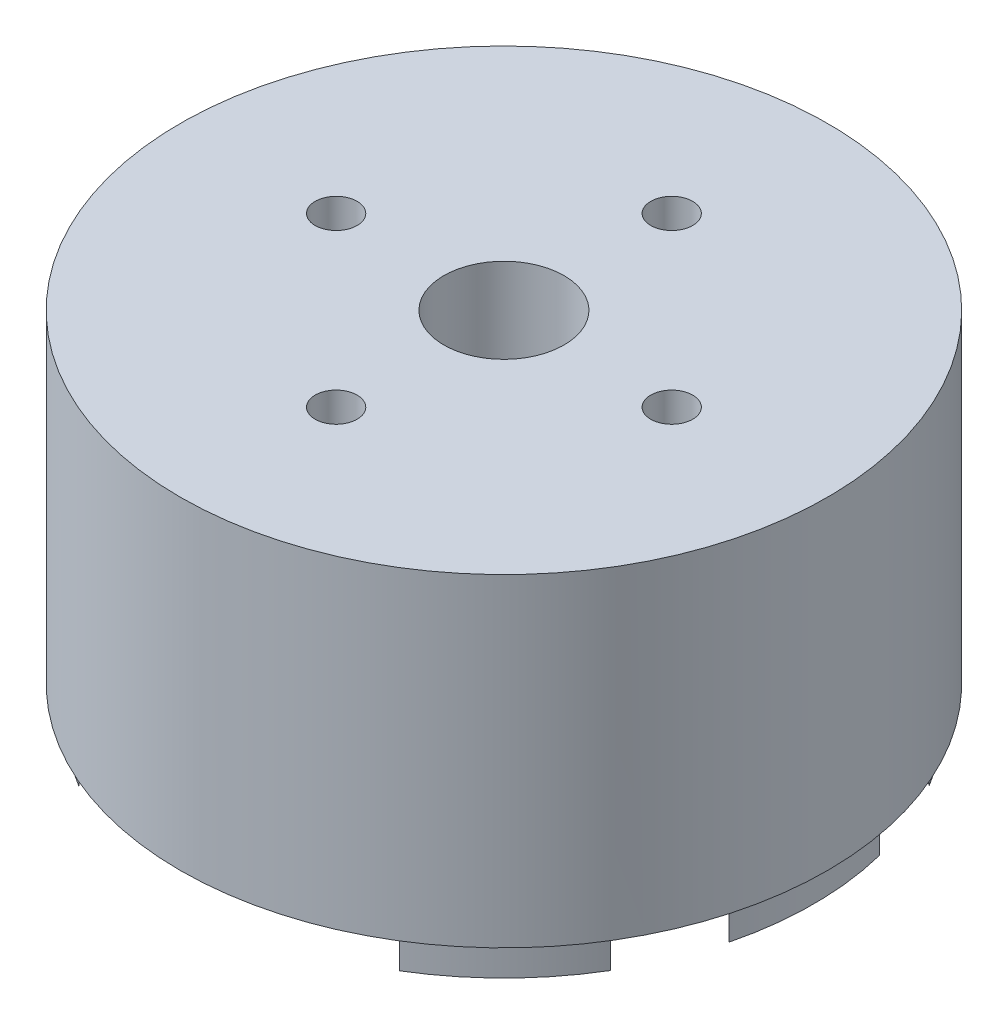
from build123d import *
from build123d.topology import SkipClean

# Parameters (mm, degrees)
EXTRUDE_1_DEPTH          = 12.85
EXTRUDE_1_DEPTH_BACK     = 12.85
SKETCH_1_R               = 23.15
CUT_EXTRUDE_1_DEPTH      = 12.85
CUT_EXTRUDE_1_DEPTH_BACK = 12.85
SKETCH_2_R               = 4.3
SKETCH_5_R               = 4.3
SKETCH_5_R_2             = 1
CUT_EXTRUDE_2_DEPTH      = 6
SKETCH_7_R               = 23.15
SKETCH_7_R_2             = 22.15
CUT_EXTRUDE_8_DEPTH      = 2.58
CUT_EXTRUDE_START        = 4
CUT_EXTRUDE_10_DEPTH     = 4
EXTRUDE_2_DEPTH          = 1
EXTRUDE_START            = 3.42
SKETCH_11_R              = 1.5
EXTRUDE_3_DEPTH          = 3.42
SKETCH_12_R              = 1.5
CUT_EXTRUDE_11_DEPTH     = 10


with BuildPart() as part:
    # 草图1 → 凸台-拉伸1 (new, two sides: drawn at the far end of the back side and taken through both)
    with BuildSketch(Plane(origin=(0, 0, 0), x_dir=(1, 0, 0), z_dir=(0, 1, 0)).offset(-EXTRUDE_1_DEPTH_BACK)):
        with Locations(Location((0, 0, 0), (0, 0, 270))):
            Circle(SKETCH_1_R)
    extrude(amount=EXTRUDE_1_DEPTH + EXTRUDE_1_DEPTH_BACK)

    # 草图2 → 切除-拉伸1 (cut, two sides: drawn at the far end of the back side and taken through both)
    with BuildSketch(Plane(origin=(0, 0, 0), x_dir=(1, 0, 0), z_dir=(0, 1, 0)).offset(-CUT_EXTRUDE_1_DEPTH_BACK)):
        with Locations(Location((0, 0, 0), (0, 0, 90))):
            Circle(SKETCH_2_R)
    extrude(amount=CUT_EXTRUDE_1_DEPTH + CUT_EXTRUDE_1_DEPTH_BACK, mode=Mode.SUBTRACT)

    # 草图5 → 切除-拉伸2 (cut)
    # profile 1 of 7: a face of its own
    with BuildSketch(Plane.XZ.offset(12.85)):
        with BuildLine():
            add(Edge.make_bspline(
                [(20.802536608, 3.817979922), (21.136448657, 2.765502233), (20.402439024, 1.997619047)],
                knots=[0, 0, 0, 1, 1, 1], degree=2))
            add(Edge.make_bspline(
                [(20.802536608, 3.817979922), (21.554654611, 4.402965713), (21.485410101, 5.38513257)],
                knots=[0, 0, 0, 1, 1, 1], degree=2))
            ThreePointArc((21.485410101, 5.38513257), (20.463931645, 8.476438027), (19.000342937, 11.384615421))
            add(Edge.make_bspline(
                [(17.409334195, 12.009895208), (18.354809355, 12.128075529), (19.000342937, 11.384615421)],
                knots=[0, 0, 0, 1, 1, 1], degree=2))
            add(Edge.make_bspline(
                [(17.409334195, 12.009895208), (16.901231558, 12.990220793), (15.839232961, 13.014173013)],
                knots=[0, 0, 0, 1, 1, 1], degree=2))
            ThreePointArc((15.839232961, 13.014173013), (13.081475452, 13.081475452), (13.014173013, 15.839232961))
            add(Edge.make_bspline(
                [(12.009895208, 17.409334195), (12.990220793, 16.901231558), (13.014173013, 15.839232961)],
                knots=[0, 0, 0, 1, 1, 1], degree=2))
            add(Edge.make_bspline(
                [(12.009895208, 17.409334195), (12.11724016, 18.301586859), (11.468959869, 18.949550378)],
                knots=[0, 0, 0, 1, 1, 1], degree=2))
            ThreePointArc((11.468959869, 18.949550378), (7.862702232, 20.707496556), (3.998499067, 21.786108079))
            ThreePointArc((3.998499067, 21.786108079), (0, 22.15), (-3.998499067, 21.786108079))
            ThreePointArc((-3.998499067, 21.786108079), (-7.816660073, 20.724920393), (-11.384615421, 19.000342937))
            add(Edge.make_bspline(
                [(-12.009895208, 17.409334195), (-12.128075529, 18.354809355), (-11.384615421, 19.000342937)],
                knots=[0, 0, 0, 1, 1, 1], degree=2))
            add(Edge.make_bspline(
                [(-12.009895208, 17.409334195), (-12.990220793, 16.901231558), (-13.014173013, 15.839232961)],
                knots=[0, 0, 0, 1, 1, 1], degree=2))
            ThreePointArc((-13.014173013, 15.839232961), (-13.081475452, 13.081475452), (-15.839232961, 13.014173013))
            add(Edge.make_bspline(
                [(-17.409334195, 12.009895208), (-16.901231558, 12.990220793), (-15.839232961, 13.014173013)],
                knots=[0, 0, 0, 1, 1, 1], degree=2))
            add(Edge.make_bspline(
                [(-17.409334195, 12.009895208), (-18.317519727, 12.120793632), (-18.964787718, 11.443746188)],
                knots=[0, 0, 0, 1, 1, 1], degree=2))
            ThreePointArc((-18.964787718, 11.443746188), (-20.450704771, 8.508300321), (-21.485410101, 5.38513257))
            add(Edge.make_bspline(
                [(-20.802536608, 3.817979922), (-21.554654611, 4.402965713), (-21.485410101, 5.38513257)],
                knots=[0, 0, 0, 1, 1, 1], degree=2))
            add(Edge.make_bspline(
                [(-20.802536608, 3.817979922), (-21.136448657, 2.765502233), (-20.402439024, 1.997619047)],
                knots=[0, 0, 0, 1, 1, 1], degree=2))
            ThreePointArc((-20.402439024, 1.997619047), (-18.5, 0), (-20.402439024, -1.997619047))
            add(Edge.make_bspline(
                [(-20.802536608, -3.817979922), (-21.136448657, -2.765502233), (-20.402439024, -1.997619047)],
                knots=[0, 0, 0, 1, 1, 1], degree=2))
            add(Edge.make_bspline(
                [(-20.802536608, -3.817979922), (-21.554654611, -4.402965713), (-21.485410101, -5.38513257)],
                knots=[0, 0, 0, 1, 1, 1], degree=2))
            ThreePointArc((-21.485410101, -5.38513257), (-20.44160266, -8.530145409), (-18.940290978, -11.484244758))
            add(Edge.make_bspline(
                [(-17.409334195, -12.009895208), (-18.291922365, -12.11493984), (-18.940290978, -11.484244758)],
                knots=[0, 0, 0, 1, 1, 1], degree=2))
            add(Edge.make_bspline(
                [(-17.409334195, -12.009895208), (-16.901231558, -12.990220793), (-15.839232961, -13.014173013)],
                knots=[0, 0, 0, 1, 1, 1], degree=2))
            ThreePointArc((-15.839232961, -13.014173013), (-13.081475452, -13.081475452), (-13.014173013, -15.839232961))
            add(Edge.make_bspline(
                [(-12.009895208, -17.409334195), (-12.990220793, -16.901231558), (-13.014173013, -15.839232961)],
                knots=[0, 0, 0, 1, 1, 1], degree=2))
            add(Edge.make_bspline(
                [(-12.009895208, -17.409334195), (-12.128075529, -18.354809355), (-11.384615421, -19.000342937)],
                knots=[0, 0, 0, 1, 1, 1], degree=2))
            ThreePointArc((-11.384615421, -19.000342937), (-7.816660073, -20.724920393), (-3.998499067, -21.786108079))
            ThreePointArc((-3.998499067, -21.786108079), (0, -22.15), (3.998499067, -21.786108079))
            ThreePointArc((3.998499067, -21.786108079), (7.68019027, -20.775879703), (11.133718408, -19.148441566))
            add(Edge.make_bspline(
                [(12.009895208, -17.409334195), (12.147339907, -18.511130847), (11.133718408, -19.148441566)],
                knots=[0, 0, 0, 1, 1, 1], degree=2))
            add(Edge.make_bspline(
                [(12.009895208, -17.409334195), (12.990220793, -16.901231558), (13.014173013, -15.839232961)],
                knots=[0, 0, 0, 1, 1, 1], degree=2))
            ThreePointArc((13.014173013, -15.839232961), (13.081475452, -13.081475452), (15.839232961, -13.014173013))
            add(Edge.make_bspline(
                [(17.409334195, -12.009895208), (16.901231558, -12.990220793), (15.839232961, -13.014173013)],
                knots=[0, 0, 0, 1, 1, 1], degree=2))
            add(Edge.make_bspline(
                [(17.409334195, -12.009895208), (18.354809355, -12.128075529), (19.000342937, -11.384615421)],
                knots=[0, 0, 0, 1, 1, 1], degree=2))
            ThreePointArc((19.000342937, -11.384615421), (20.463931645, -8.476438027), (21.485410101, -5.38513257))
            add(Edge.make_bspline(
                [(20.802536608, -3.817979922), (21.554654611, -4.402965713), (21.485410101, -5.38513257)],
                knots=[0, 0, 0, 1, 1, 1], degree=2))
            add(Edge.make_bspline(
                [(20.802536608, -3.817979922), (21.136448657, -2.765502233), (20.402439024, -1.997619047)],
                knots=[0, 0, 0, 1, 1, 1], degree=2))
            ThreePointArc((20.402439024, -1.997619047), (18.5, 0), (20.402439024, 1.997619047))
        make_face()
        with Locations(Location((0, 0, 0), (0, 0, 270))):
            Circle(SKETCH_5_R, mode=Mode.SUBTRACT)
    # profile 2 of 7: a face of its own
    with BuildSketch(Plane.XZ.offset(12.85)):
        with Locations(Location((20.5, 0, 0), (0, 0, 270))):
            Circle(SKETCH_5_R_2)
    # profile 3 of 7: a face of its own
    with BuildSketch(Plane.XZ.offset(12.85)):
        with Locations(Location((14.495689014, -14.495689014, 0), (0, 0, 270))):
            Circle(SKETCH_5_R_2)
    # profile 4 of 7: a face of its own
    with BuildSketch(Plane.XZ.offset(12.85)):
        with Locations(Location((-14.495689014, -14.495689014, 0), (0, 0, 270))):
            Circle(SKETCH_5_R_2)
    # profile 5 of 7: a face of its own
    with BuildSketch(Plane.XZ.offset(12.85)):
        with Locations(Location((-20.5, 0, 0), (0, 0, 270))):
            Circle(SKETCH_5_R_2)
    # profile 6 of 7: a face of its own
    with BuildSketch(Plane.XZ.offset(12.85)):
        with Locations(Location((-14.495689014, 14.495689014, 0), (0, 0, 270))):
            Circle(SKETCH_5_R_2)
    # profile 7 of 7: a face of its own
    with BuildSketch(Plane.XZ.offset(12.85)):
        with Locations(Location((14.495689014, 14.495689014, 0), (0, 0, 270))):
            Circle(SKETCH_5_R_2)
    extrude(amount=-CUT_EXTRUDE_2_DEPTH, mode=Mode.SUBTRACT)

    # 草图7 → 切除-拉伸8 (cut)
    with BuildSketch(Plane.XZ.offset(12.85)):
        with Locations(Location((0, 0, 0), (0, 0, 90))):
            Circle(SKETCH_7_R)
        Circle(SKETCH_7_R_2, mode=Mode.SUBTRACT)
    extrude(amount=-CUT_EXTRUDE_8_DEPTH, mode=Mode.SUBTRACT)

    # 草图10 → 切除-拉伸10 (cut)
    with BuildSketch(Plane.XZ.offset(6.85).offset(CUT_EXTRUDE_START)):
        with BuildLine():
            Line((-9, -21.328912302), (-9, -20.239132887))
            ThreePointArc((-9, -20.239132887), (0, -22.15), (9, -20.239132887))
            Line((9, -20.239132887), (9, -21.328912302))
            ThreePointArc((9, -21.328912302), (0, -23.15), (-9, -21.328912302))
        make_face()
    extrude(amount=-CUT_EXTRUDE_10_DEPTH, mode=Mode.SUBTRACT)

    # 草图9 → 凸台-拉伸2 (add)
    with SkipClean():  # the faces are left unmerged after this step: merging them gives an invalid solid
        with BuildSketch(Plane(origin=(0, -7.85, 0), x_dir=(-1, 0, 0), z_dir=(0, -1, 0))):
            with BuildLine():
                Line((-9, 21.328912302), (-9, 20.239132887))
                ThreePointArc((-9, 20.239132887), (0, 22.15), (9, 20.239132887))
                Line((9, 20.239132887), (9, 21.328912302))
                ThreePointArc((9, 21.328912302), (0, 23.15), (-9, 21.328912302))
            make_face()
        extrude(amount=-EXTRUDE_2_DEPTH)

    # 草图11 → 凸台-拉伸3 (add)
    with SkipClean():  # the faces are left unmerged after this step: merging them gives an invalid solid
        with BuildSketch(Plane.XZ.offset(6.85).offset(EXTRUDE_START)):
            with BuildLine():
                Line((2.5, -9.67), (-2.5, -9.67))
                Line((-2.5, -9.67), (-2.5, -14.67))
                add(Edge.make_bspline(
                    [(-2.5, -14.67), (-2.658334467, -17.044766609), (-3.5, -19.27)],
                    knots=[0, 0, 0, 1, 1, 1], degree=2))
                Line((-3.5, -19.27), (-3.5, -22.883891714))
                ThreePointArc((-3.5, -22.883891714), (0, -23.15), (3.5, -22.883891714))
                Line((3.5, -22.883891714), (3.5, -19.27))
                add(Edge.make_bspline(
                    [(2.5, -14.67), (2.658334467, -17.044766609), (3.5, -19.27)],
                    knots=[0, 0, 0, 1, 1, 1], degree=2))
                Line((2.5, -14.67), (2.5, -9.67))
            make_face()
            with Locations(Location((0, -12.5, 0), (0, 0, 270))):
                Circle(SKETCH_11_R, mode=Mode.SUBTRACT)
            with Locations(Location((0, -19, 0), (0, 0, 270))):
                Circle(SKETCH_11_R, mode=Mode.SUBTRACT)
        extrude(amount=-EXTRUDE_3_DEPTH)

    # 草图12 → 切除-拉伸11 (cut)
    with SkipClean():  # the faces are left unmerged after this step: merging them gives an invalid solid
        with BuildSketch(Plane(origin=(0, 12.85, 0), x_dir=(1, 0, 0), z_dir=(0, 1, 0))):
            with Locations(Location((0, 12, 0), (0, 0, 270))):
                Circle(SKETCH_12_R)
            with Locations(Location((12, 0, 0), (0, 0, 270))):
                Circle(SKETCH_12_R)
            with Locations(Location((0, -12, 0), (0, 0, 270))):
                Circle(SKETCH_12_R)
            with Locations(Location((-12, 0, 0), (0, 0, 270))):
                Circle(SKETCH_12_R)
        extrude(amount=-CUT_EXTRUDE_11_DEPTH, mode=Mode.SUBTRACT)


solid = part.part
